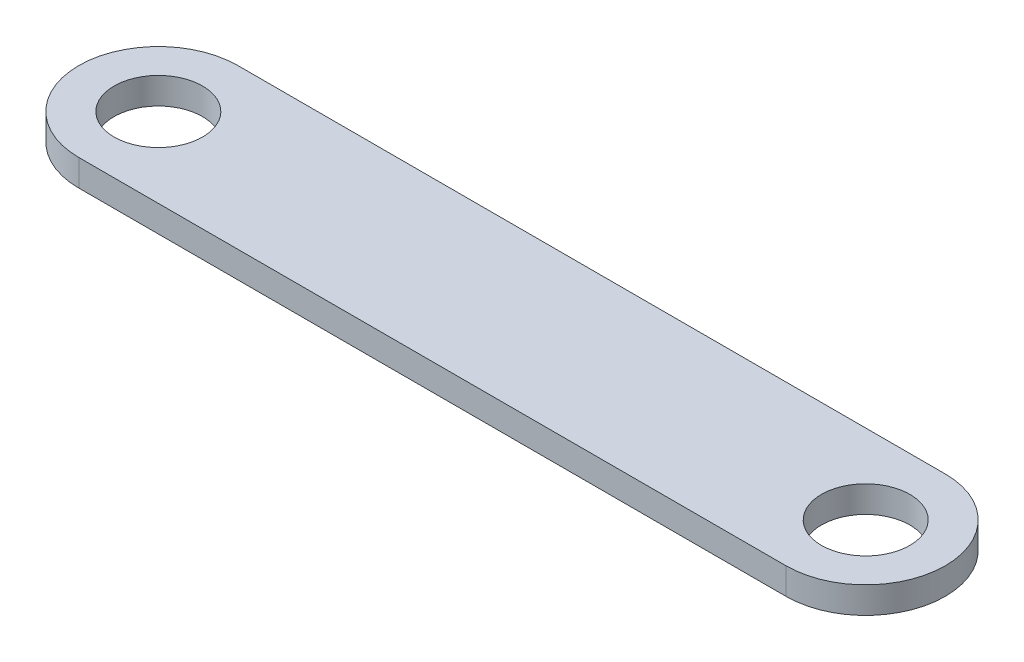
from build123d import *

# Parameters (mm, degrees)
SKETCH1_R           = 5
BOSS_EXTRUDE1_DEPTH = 1.5


with BuildPart() as part:
    # Sketch1 → Boss-Extrude1 (new, symmetric)
    with BuildSketch(Plane(origin=(0, 0, 0), x_dir=(1, 0, 0), z_dir=(0, 1, 0))):
        with BuildLine():
            Line((0, 9), (80, 9))
            ThreePointArc((80, 9), (89, 0), (80, -9))
            Line((80, -9), (0, -9))
            ThreePointArc((0, -9), (-9, 0), (0, 9))
        make_face()
        with Locations(Location((0, 0, 0), (0, 0, 270))):
            Circle(SKETCH1_R, mode=Mode.SUBTRACT)
        with Locations(Location((80, 0, 0), (0, 0, 270))):
            Circle(SKETCH1_R, mode=Mode.SUBTRACT)
    extrude(amount=BOSS_EXTRUDE1_DEPTH, both=True)


solid = part.part
